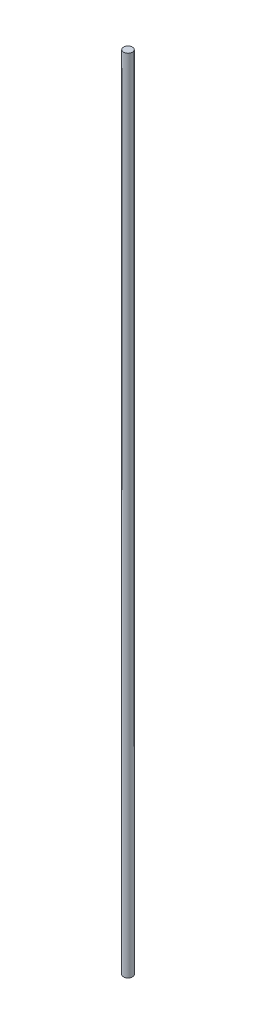
from build123d import *

# Parameters (mm, degrees)
SKETCH1_R           = 2
BOSS_EXTRUDE2_DEPTH = 360


with BuildPart() as part:
    # Sketch1 → Boss-Extrude2 (new body)
    with BuildSketch(Plane(origin=(0, 0, 0), x_dir=(1, 0, 0), z_dir=(0, 1, 0))):
        with Locations(Location((0, 0, 0), (0, 0, 90))):
            Circle(SKETCH1_R)
    extrude(amount=BOSS_EXTRUDE2_DEPTH)


solid = part.part
